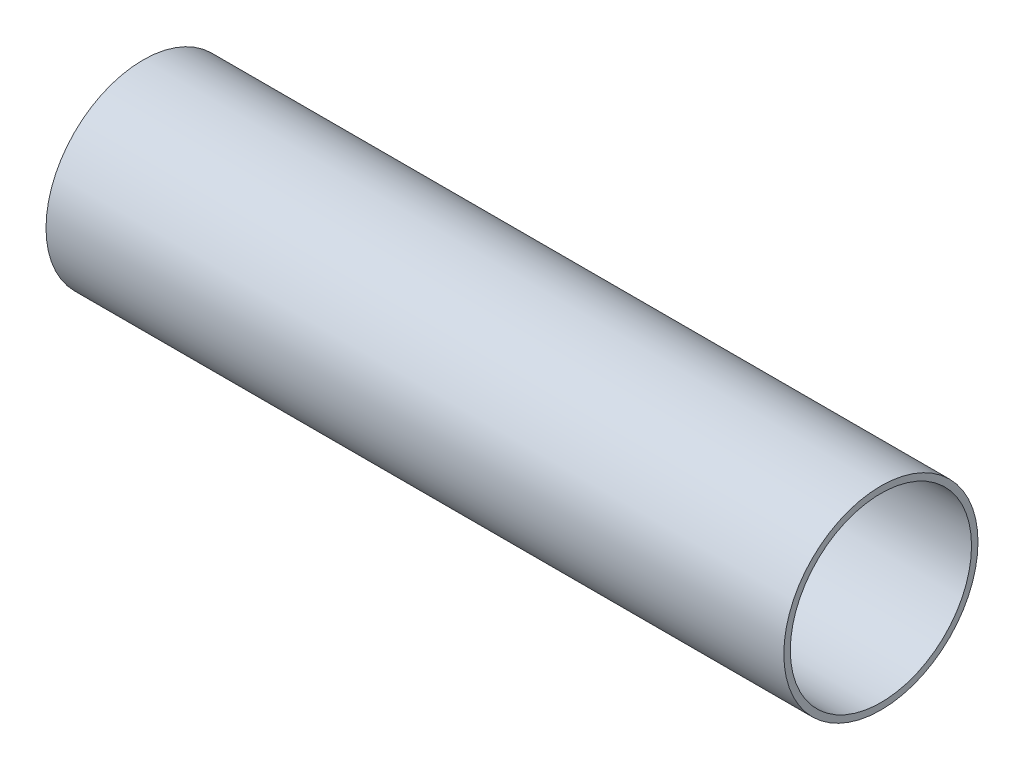
from build123d import *

# Parameters (mm, degrees)
SZKIC1_W = 570
SZKIC1_H = 5


with BuildPart() as part:
    # Szkic1 → Obrót1 (revolve)
    with BuildSketch(Plane.XY, mode=Mode.PRIVATE) as obr_t1_sk:
        with Locations((126.315789474, 72.5)):
            Rectangle(SZKIC1_W, SZKIC1_H)
    revolve(obr_t1_sk.sketch.rotate(Axis((0, 0, 0), (1, 0, 0)), 90), axis=Axis((0, 0, 0), (1, 0, 0)))


solid = part.part
